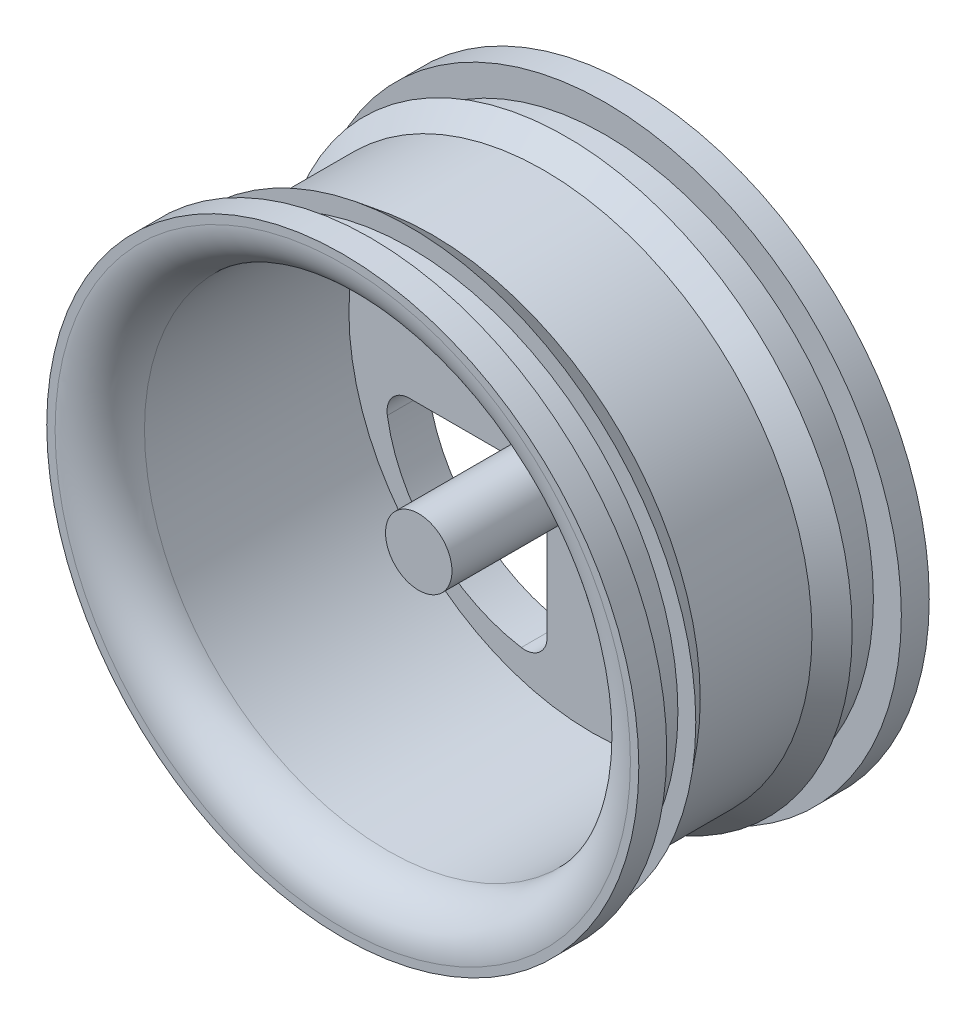
from build123d import *

# Parameters (mm, degrees)
SKETCH_3_R          = 21.75
CUT_EXTRUDE_1_DEPTH = 22.3
FILLET_1_R          = 4
CUT_EXTRUDE_3_REACH = 45.61
SKETCH_4_R          = 1.35
SKETCH_6_R          = 2.975
EXTRUDE_2_DEPTH     = 15.5
FILLET_2_R          = 2


with BuildPart() as part:
    # 草图1 → 旋转1 (revolve)
    with BuildSketch(Plane(origin=(0, 0, 0), x_dir=(0, 0, -1), z_dir=(1, 0, 0))):
        Polygon((-5, 24), (5, 24), (7, 25.6), (7, 24), (10.5, 24), (10.5, 26.5), (13, 26.5), (13, 0), (-13, 0), (-13, 26.5), (-10.5, 26.5), (-10.5, 24), (-7, 24), (-7, 25.6), align=None)
    revolve(axis=Axis((0, 0, -13), (0, 0, 1)))

    # 草图3 → 切除-拉伸1 (cut)
    with BuildSketch(Plane.XY.offset(13)):
        Circle(SKETCH_3_R)
    extrude(amount=-CUT_EXTRUDE_1_DEPTH, mode=Mode.SUBTRACT)

    # 圆角1
    fillet_1_edges = [part.edges().sort_by_distance(p)[0] for p in [
        (-21.75, 0, 13),
    ]]
    fillet(fillet_1_edges, radius=FILLET_1_R)

    # 草图4 → 切除-拉伸3 (cut, up to next)
    with BuildSketch(Plane.XY.offset(-9.3), mode=Mode.PRIVATE) as cut_extrude_3_sk1:
        with Locations((8, 0)):
            Circle(SKETCH_4_R)
    cut_extrude_3_tool1 = extrude(cut_extrude_3_sk1.sketch, amount=-CUT_EXTRUDE_3_REACH, mode=Mode.PRIVATE) & part.part
    # 草图4 → 切除-拉伸3 (cut, up to next)
    with BuildSketch(Plane.XY.offset(-9.3), mode=Mode.PRIVATE) as cut_extrude_3_sk2:
        with BuildLine():
            Line((-18.5, 4), (-4, 4))
            Line((-4, 4), (-4, 18.5))
            ThreePointArc((-4, 18.5), (-14.253048327, 14.253048327), (-18.5, 4))
        make_face()
    cut_extrude_3_tool2 = extrude(cut_extrude_3_sk2.sketch, amount=-CUT_EXTRUDE_3_REACH, mode=Mode.PRIVATE) & part.part
    # 草图4 → 切除-拉伸3 (cut, up to next)
    with BuildSketch(Plane.XY.offset(-9.3), mode=Mode.PRIVATE) as cut_extrude_3_sk3:
        with BuildLine():
            Line((4, 18.5), (4, 4))
            Line((4, 4), (18.5, 4))
            ThreePointArc((18.5, 4), (14.253048327, 14.253048327), (4, 18.5))
        make_face()
    cut_extrude_3_tool3 = extrude(cut_extrude_3_sk3.sketch, amount=-CUT_EXTRUDE_3_REACH, mode=Mode.PRIVATE) & part.part
    # 草图4 → 切除-拉伸3 (cut, up to next)
    with BuildSketch(Plane.XY.offset(-9.3), mode=Mode.PRIVATE) as cut_extrude_3_sk4:
        with BuildLine():
            Line((18.5, -4), (4, -4))
            Line((4, -4), (4, -18.5))
            ThreePointArc((4, -18.5), (14.253048327, -14.253048327), (18.5, -4))
        make_face()
    cut_extrude_3_tool4 = extrude(cut_extrude_3_sk4.sketch, amount=-CUT_EXTRUDE_3_REACH, mode=Mode.PRIVATE) & part.part
    # 草图4 → 切除-拉伸3 (cut, up to next)
    with BuildSketch(Plane.XY.offset(-9.3), mode=Mode.PRIVATE) as cut_extrude_3_sk5:
        with BuildLine():
            Line((-4, -18.5), (-4, -4))
            Line((-4, -4), (-18.5, -4))
            ThreePointArc((-18.5, -4), (-14.253048327, -14.253048327), (-4, -18.5))
        make_face()
    cut_extrude_3_tool5 = extrude(cut_extrude_3_sk5.sketch, amount=-CUT_EXTRUDE_3_REACH, mode=Mode.PRIVATE) & part.part
    # 草图4 → 切除-拉伸3 (cut, up to next)
    with BuildSketch(Plane.XY.offset(-9.3), mode=Mode.PRIVATE) as cut_extrude_3_sk6:
        with Locations((0, -8)):
            Circle(SKETCH_4_R)
    cut_extrude_3_tool6 = extrude(cut_extrude_3_sk6.sketch, amount=-CUT_EXTRUDE_3_REACH, mode=Mode.PRIVATE) & part.part
    # 草图4 → 切除-拉伸3 (cut, up to next)
    with BuildSketch(Plane.XY.offset(-9.3), mode=Mode.PRIVATE) as cut_extrude_3_sk7:
        with Locations((-8, 0)):
            Circle(SKETCH_4_R)
    cut_extrude_3_tool7 = extrude(cut_extrude_3_sk7.sketch, amount=-CUT_EXTRUDE_3_REACH, mode=Mode.PRIVATE) & part.part
    # 草图4 → 切除-拉伸3 (cut, up to next)
    with BuildSketch(Plane.XY.offset(-9.3), mode=Mode.PRIVATE) as cut_extrude_3_sk8:
        with Locations((0, 8)):
            Circle(SKETCH_4_R)
    cut_extrude_3_tool8 = extrude(cut_extrude_3_sk8.sketch, amount=-CUT_EXTRUDE_3_REACH, mode=Mode.PRIVATE) & part.part
    add(cut_extrude_3_tool1.solids().sort_by_distance((8, 0, -9.3))[0], mode=Mode.SUBTRACT)
    add(cut_extrude_3_tool2.solids().sort_by_distance((-10.153991, 10.153991, -9.3))[0], mode=Mode.SUBTRACT)
    add(cut_extrude_3_tool3.solids().sort_by_distance((10.153991, 10.153991, -9.3))[0], mode=Mode.SUBTRACT)
    add(cut_extrude_3_tool4.solids().sort_by_distance((10.153991, -10.153991, -9.3))[0], mode=Mode.SUBTRACT)
    add(cut_extrude_3_tool5.solids().sort_by_distance((-10.153991, -10.153991, -9.3))[0], mode=Mode.SUBTRACT)
    add(cut_extrude_3_tool6.solids().sort_by_distance((0, -8, -9.3))[0], mode=Mode.SUBTRACT)
    add(cut_extrude_3_tool7.solids().sort_by_distance((-8, 0, -9.3))[0], mode=Mode.SUBTRACT)
    add(cut_extrude_3_tool8.solids().sort_by_distance((0, 8, -9.3))[0], mode=Mode.SUBTRACT)

    # 草图6 → 凸台-拉伸2 (add)
    with BuildSketch(Plane.XY.offset(-9.3)):
        Circle(SKETCH_6_R)
    extrude(amount=EXTRUDE_2_DEPTH)

    # 圆角2
    fillet_2_edges = [part.edges().sort_by_distance(p)[0] for p in [
        (18.5, -4, -11.15),
        (4, -18.5, -11.15),
        (4, -4, -11.15),
        (4, 18.5, -11.15),
        (18.5, 4, -11.15),
        (4, 4, -11.15),
        (-4, 18.5, -11.15),
        (-4, 4, -11.15),
        (-18.5, 4, -11.15),
        (-4, -4, -11.15),
        (-18.5, -4, -11.15),
        (-4, -18.5, -11.15),
    ]]
    fillet(fillet_2_edges, radius=FILLET_2_R)


solid = part.part
